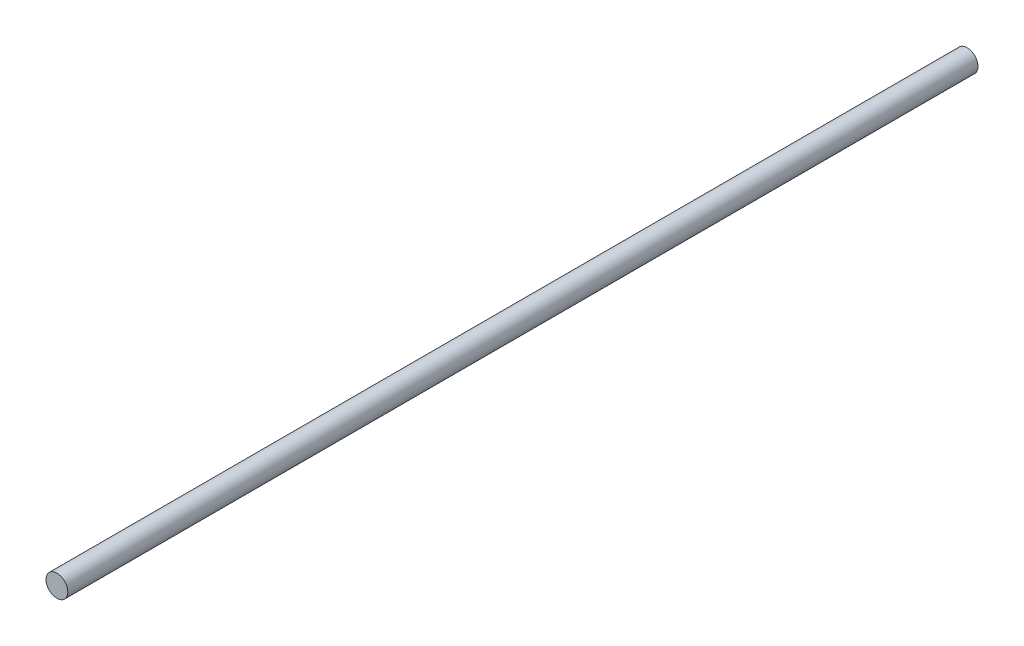
from build123d import *

# Parameters (mm, degrees)
SKETCH1_R           = 12.7
BOSS_EXTRUDE1_DEPTH = 1060


with BuildPart() as part:
    # Sketch1 → Boss-Extrude1 (new body)
    with BuildSketch(Plane.XY):
        Circle(SKETCH1_R)
    extrude(amount=BOSS_EXTRUDE1_DEPTH)


solid = part.part
